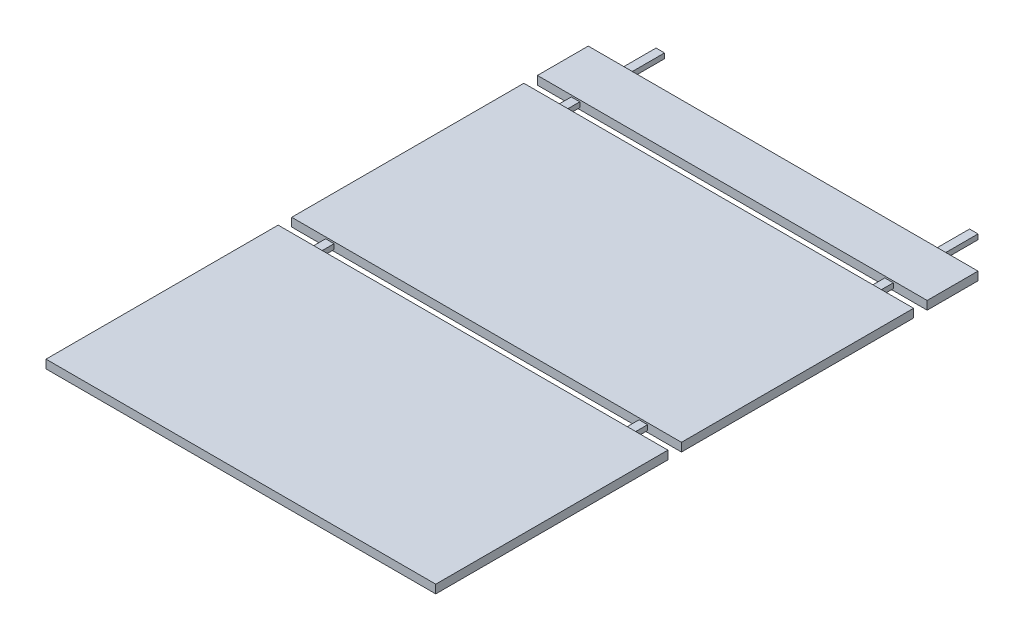
from build123d import *

# Parameters (mm, degrees)
SCHIZZO1_W                   = 2300
SCHIZZO1_H                   = 50
ESTRUSIONE_ESTRUSIONE1_DEPTH = 3400
SCHIZZO2_W                   = 200
SCHIZZO2_H                   = 80
SCHIZZO2_H_2                 = 200
SCHIZZO2_W_2                 = 1800
TAGLIO_ESTRUSIONE1_DEPTH     = 3590.56821916
SCHIZZO3_W                   = 80
SCHIZZO3_H                   = 10
SCHIZZO3_W_2                 = 200
TAGLIO_ESTRUSIONE2_DEPTH     = 4105.951278639


with BuildPart() as part:
    # Schizzo1 → Estrusione-Estrusione1 (new body)
    with BuildSketch(Plane.XY):
        Rectangle(SCHIZZO1_W, SCHIZZO1_H)
    extrude(amount=ESTRUSIONE_ESTRUSIONE1_DEPTH)

    # Schizzo2 → Taglio-Estrusione1 (cut, through all)
    with BuildSketch(Plane(origin=(0, 25, 0), x_dir=(1, 0, 0), z_dir=(0, 1, 0))):
        with Locations((-1050, -1990)):
            Rectangle(SCHIZZO2_W, SCHIZZO2_H)
        with Locations((1050, -1990)):
            Rectangle(SCHIZZO2_W, SCHIZZO2_H)
        with Locations((-1050, -540)):
            Rectangle(SCHIZZO2_W, SCHIZZO2_H)
        with Locations((1050, -540)):
            Rectangle(SCHIZZO2_W, SCHIZZO2_H)
        with Locations((-1050, -100)):
            Rectangle(SCHIZZO2_W, SCHIZZO2_H_2)
        with Locations((1050, -100)):
            Rectangle(SCHIZZO2_W, SCHIZZO2_H_2)
        with Locations((0, -100)):
            Rectangle(SCHIZZO2_W_2, SCHIZZO2_H_2)
        with Locations((0, -1990)):
            Rectangle(SCHIZZO2_W_2, SCHIZZO2_H)
        with Locations((0, -540)):
            Rectangle(SCHIZZO2_W_2, SCHIZZO2_H)
    extrude(amount=-TAGLIO_ESTRUSIONE1_DEPTH, mode=Mode.SUBTRACT)

    # Schizzo3 → Taglio-Estrusione2 (cut, through all)
    with BuildSketch(Plane(origin=(1150, 0, 0), x_dir=(0, 0, -1), z_dir=(1, 0, 0))):
        with Locations((-1990, 20)):
            Rectangle(SCHIZZO3_W, SCHIZZO3_H)
        with Locations((-1990, -20)):
            Rectangle(SCHIZZO3_W, SCHIZZO3_H)
        with Locations((-540, 20)):
            Rectangle(SCHIZZO3_W, SCHIZZO3_H)
        with Locations((-540, -20)):
            Rectangle(SCHIZZO3_W, SCHIZZO3_H)
        with Locations((-100, 20)):
            Rectangle(SCHIZZO3_W_2, SCHIZZO3_H)
        with Locations((-100, -20)):
            Rectangle(SCHIZZO3_W_2, SCHIZZO3_H)
    extrude(amount=-TAGLIO_ESTRUSIONE2_DEPTH, mode=Mode.SUBTRACT)


solid = part.part
